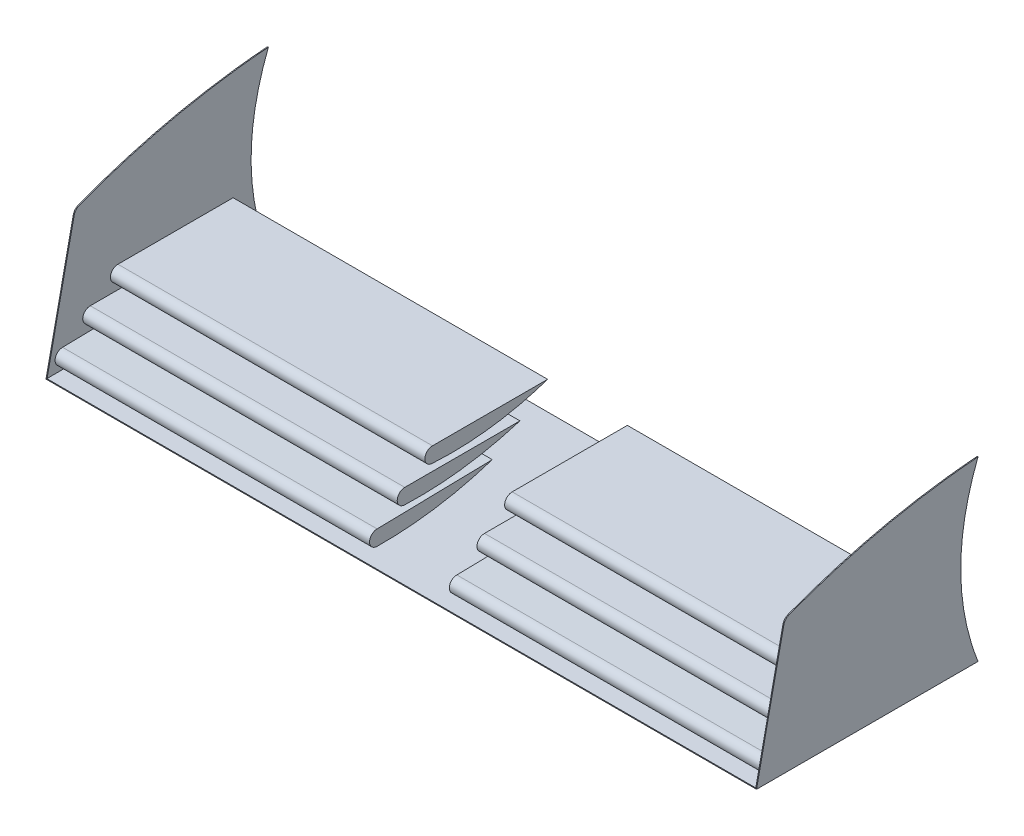
from build123d import *

# Parameters (mm, degrees)
BOSS_EXTRUDE1_START      = 1016
SKETCH1_W                = 635
SKETCH1_H                = 508
BOSS_EXTRUDE1_DEPTH      = 2.54
CUT_EXTRUDE1_DEPTH       = 1304.346742659
CUT_EXTRUDE1_DEPTH_BACK  = 1304.346742659
CUT_EXTRUDE2_DEPTH       = 1304.346742825
CUT_EXTRUDE2_DEPTH_BACK  = 1304.346742825
BOSS_EXTRUDE2_DEPTH      = 1016
BOSS_EXTRUDE2_DEPTH_BACK = 1018.54
SKETCH6_W                = 2037.0800025
SKETCH6_H                = 635
BOSS_EXTRUDE3_DEPTH      = 2.54
SKETCH7_W                = 228.6
SKETCH7_H                = 635
CUT_EXTRUDE3_DEPTH       = 182.122850144
SCALE1_SCALE             = 0.15


with BuildPart() as part:
    # Sketch1 → Boss-Extrude1 (new body)
    with BuildSketch(Plane(origin=(0, 0, 0), x_dir=(0, 0, -1), z_dir=(1, 0, 0)).offset(BOSS_EXTRUDE1_START)):
        with Locations((317.5, 254)):
            Rectangle(SKETCH1_W, SKETCH1_H)
    extrude(amount=BOSS_EXTRUDE1_DEPTH)


with BuildPart() as body_2:
    # Mirror2: mirrored copy
    add(part.part.mirror(Plane(origin=(0, 0, 0), x_dir=(0, 0, 1), z_dir=(1, 0, 0))))


with BuildPart() as cut_extrude1_tool:
    # Sketch2 → Cut-Extrude1 (new, two sides: drawn at the far end of the back side and taken through both)
    with BuildSketch(Plane(origin=(0, 0, 0), x_dir=(0, 0, -1), z_dir=(1, 0, 0)).offset(-CUT_EXTRUDE1_DEPTH_BACK)):
        with BuildLine():
            Line((635, 508), (635, 0))
            add(Edge.make_bspline(
                [(635, 508), (535.978469305, 253.949693989), (635, 0)],
                knots=[0, 0, 0, 1, 1, 1], degree=2))
        make_face()
    extrude(amount=CUT_EXTRUDE1_DEPTH + CUT_EXTRUDE1_DEPTH_BACK)


with BuildPart() as part_1:
    add(part.part)

    # Cut-Extrude1: cut by cut_extrude1_tool
    add(cut_extrude1_tool.part, mode=Mode.SUBTRACT)


with BuildPart() as body_2_1:
    add(body_2.part)

    # Cut-Extrude1: cut by cut_extrude1_tool
    add(cut_extrude1_tool.part, mode=Mode.SUBTRACT)


with BuildPart() as cut_extrude2_tool:
    # Sketch3 → Cut-Extrude2 (new, two sides: drawn at the far end of the back side and taken through both)
    with BuildSketch(Plane(origin=(0, 0, 0), x_dir=(0, 0, -1), z_dir=(1, 0, 0)).offset(-CUT_EXTRUDE2_DEPTH_BACK)):
        with BuildLine():
            Line((0, 0), (78.126052631, 368.542434052))
            ThreePointArc((78.126052631, 368.542434052), (83.696209203, 379.813815366), (93.989588341, 387.033027713))
            add(Edge.make_bspline(
                [(635, 508), (448.701490757, 493.282812039), (268.257998273, 452.93411167), (93.989588341, 387.033027713)],
                knots=[0, 0, 0, 0, 0.975723085, 0.975723085, 0.975723085, 0.975723085], degree=3))
            Line((635, 508), (0, 508))
            Line((0, 508), (0, 0))
        make_face()
    extrude(amount=CUT_EXTRUDE2_DEPTH + CUT_EXTRUDE2_DEPTH_BACK)


with BuildPart() as part_2:
    add(part_1.part)

    # Cut-Extrude2: cut by cut_extrude2_tool
    add(cut_extrude2_tool.part, mode=Mode.SUBTRACT)



with BuildPart() as body_2_2:
    add(body_2_1.part)

    # Cut-Extrude2: cut by cut_extrude2_tool
    add(cut_extrude2_tool.part, mode=Mode.SUBTRACT)


with BuildPart() as part_3:
    add(part_2.part)

    add(body_2_2.part)  # Boss-Extrude2 merges body 2
    # Sketch4 → Boss-Extrude2 (add, two sides: drawn at the far end of the back side and taken through both)
    with BuildSketch(Plane(origin=(0, 0, 0), x_dir=(0, 0, -1), z_dir=(1, 0, 0)).offset(-BOSS_EXTRUDE2_DEPTH_BACK)):
        with BuildLine():
            Line((45.081165504, 57.724816481), (375.281165504, 64.574520115))
            add(Edge.make_bspline(
                [(375.281165504, 64.574520115), (213.984471731, 12.310346682), (45.081165504, 14.405048326)],
                knots=[0, 0, 0, 1, 1, 1], degree=2))
            ThreePointArc((45.081165504, 14.405048326), (23.421281427, 36.064932403), (45.081165504, 57.724816481))
        make_face()
        with BuildLine():
            Line((124.417436543, 121.193833312), (454.617436543, 121.193833312))
            add(Edge.make_bspline(
                [(454.617436543, 121.193833312), (292.934450552, 71.316103557), (124.417436543, 77.874065157)],
                knots=[0, 0, 0, 1, 1, 1], degree=2))
            ThreePointArc((124.417436543, 77.874065157), (102.757552466, 99.533949235), (124.417436543, 121.193833312))
        make_face()
        with BuildLine():
            Line((203.753707583, 184.662850144), (533.953707583, 184.662850144))
            add(Edge.make_bspline(
                [(203.753707583, 141.343081989), (373.054781607, 130.66856222), (533.953707583, 184.662850144)],
                knots=[0, 0, 0, 1, 1, 1], degree=2))
            ThreePointArc((203.753707583, 141.343081989), (182.093823506, 163.002966066), (203.753707583, 184.662850144))
        make_face()
    extrude(amount=BOSS_EXTRUDE2_DEPTH + BOSS_EXTRUDE2_DEPTH_BACK)

    # Sketch6 → Boss-Extrude3 (add)
    with BuildSketch(Plane(origin=(0, 0, 0), x_dir=(1, 0, 0), z_dir=(0, 1, 0))):
        with Locations((-1.25e-06, 317.5)):
            Rectangle(SKETCH6_W, SKETCH6_H)
    extrude(amount=BOSS_EXTRUDE3_DEPTH)

    # Sketch7 → Cut-Extrude3 (cut)
    with BuildSketch(Plane(origin=(0, 184.662850144, 0), x_dir=(1, 0, 0), z_dir=(0, 1, 0))):
        with Locations((0, 317.5)):
            Rectangle(SKETCH7_W, SKETCH7_H)
    extrude(amount=-CUT_EXTRUDE3_DEPTH, mode=Mode.SUBTRACT)


with BuildPart() as part_4:
    # Scale1: scaled about (-9.86e-07, 101.456945175, -249.81115195)
    add(part_3.part.scale(SCALE1_SCALE).moved(Location((-8.38e-07, 86.238403399, -212.339479157))))


solid = part_4.part
